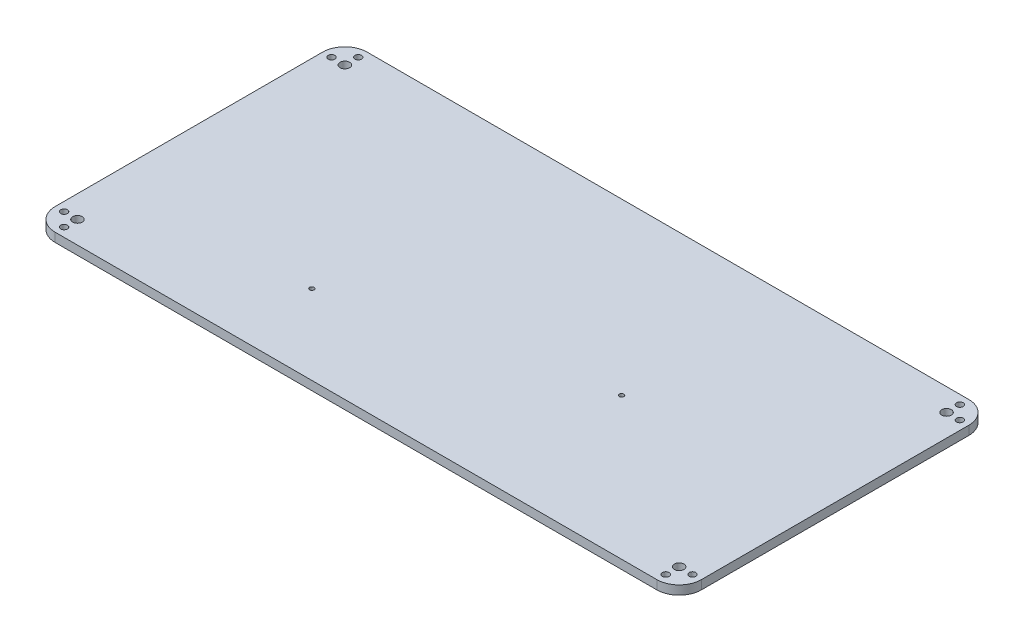
from build123d import *

# Parameters (mm, degrees)
SKETCH1_R                 = 2.15
SKETCH1_R_2               = 1.5
BOSS_EXTRUDE1_DEPTH       = 4
MIRROR2_COPY_1_SKETCH_R   = 2.15
MIRROR2_COPY_1_SKETCH_R_2 = 1.5
MIRROR2_COPY_1_DEPTH      = 4
SKETCH2_R                 = 1
CUT_EXTRUDE1_DEPTH        = 10


with BuildPart() as part:
    # Sketch1 → Boss-Extrude1 (new body)
    with BuildSketch(Plane(origin=(0, 0, 0), x_dir=(1, 0, 0), z_dir=(0, 1, 0))):
        with BuildLine():
            Line((145, 0), (145, -60))
            ThreePointArc((145, -60), (142.071067812, -67.071067812), (135, -70))
            Line((135, -70), (0, -70))
            Line((0, -70), (0, 0))
            Line((0, 0), (145, 0))
        make_face()
        with Locations(Location((135, -60, 0), (0, 0, 270))):
            Circle(SKETCH1_R, mode=Mode.SUBTRACT)
        with Locations(Location((141, -60, 0), (0, 0, 270))):
            Circle(SKETCH1_R_2, mode=Mode.SUBTRACT)
        with Locations(Location((135, -66, 0), (0, 0, 270))):
            Circle(SKETCH1_R_2, mode=Mode.SUBTRACT)
    boss_extrude1 = extrude(amount=BOSS_EXTRUDE1_DEPTH)

    # Mirror1: Boss-Extrude1 across plane
    add(boss_extrude1.mirror(Plane(origin=(0, 0, 0), x_dir=(0, 0, 1), z_dir=(1, 0, 0))))

    # Mirror2: Boss-Extrude1 across plane
    add(boss_extrude1.mirror(Plane.XY))

    # Mirror2 copy 1 sketch → Mirror2 copy 1 (add)
    with BuildSketch(Plane(origin=(0, 0, 0), x_dir=(-1, 0, 0), z_dir=(0, 1, 0))):
        with BuildLine():
            Line((145, 0), (145, -60))
            ThreePointArc((145, -60), (142.071067812, -67.071067812), (135, -70))
            Line((135, -70), (0, -70))
            Line((0, -70), (0, 0))
            Line((0, 0), (145, 0))
        make_face()
        with Locations(Location((135, -60, 0), (0, 0, 270))):
            Circle(MIRROR2_COPY_1_SKETCH_R, mode=Mode.SUBTRACT)
        with Locations(Location((141, -60, 0), (0, 0, 270))):
            Circle(MIRROR2_COPY_1_SKETCH_R_2, mode=Mode.SUBTRACT)
        with Locations(Location((135, -66, 0), (0, 0, 270))):
            Circle(MIRROR2_COPY_1_SKETCH_R_2, mode=Mode.SUBTRACT)
    extrude(amount=MIRROR2_COPY_1_DEPTH)

    # Sketch2 → Cut-Extrude1 (cut)
    with BuildSketch(Plane(origin=(0, 6, 0), x_dir=(1, 0, 0), z_dir=(0, 1, 0))):
        with Locations(Location((55.5, -6.309138883, 0), (0, 0, 270))):
            Circle(SKETCH2_R)
        with Locations(Location((-55.5, -34.309138883, 0), (0, 0, 270))):
            Circle(SKETCH2_R)
    extrude(amount=-CUT_EXTRUDE1_DEPTH, mode=Mode.SUBTRACT)


solid = part.part
